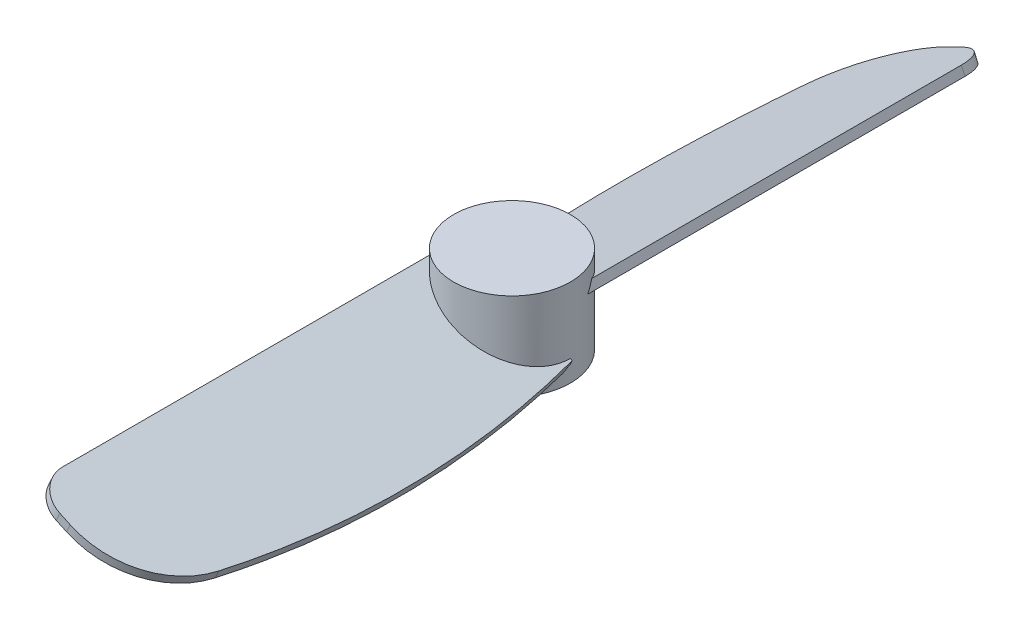
from build123d import *

# Parameters (mm, degrees)
SKETCH1_R           = 2
BOSS_EXTRUDE1_DEPTH = 3
BOSS_EXTRUDE2_DEPTH = 0.15
CIRPATTERN1_COUNT   = 2


with BuildPart() as part:
    # Sketch1 → Boss-Extrude1 (new body)
    with BuildSketch(Plane(origin=(0, 0, 0), x_dir=(1, 0, 0), z_dir=(0, 1, 0))):
        with Locations(Location((0, 0, 0), (0, 0, 270))):
            Circle(SKETCH1_R)
    extrude(amount=BOSS_EXTRUDE1_DEPTH)

    # Sketch3 → Boss-Extrude2 (add, symmetric)
    with BuildSketch(Plane(origin=(0.574533332, 1.232090707, 0), x_dir=(0.9063077870366496, -0.4226182617407003, 0), z_dir=(-0.42261826174070033, -0.9063077870366497, 0))):
        with BuildLine():
            Line((-1.825963844, 0), (-2.618118511, 0.610320395))
            Line((-2.618118511, 0.610320395), (-2.618118511, 13.644717252))
            ThreePointArc((-2.618118511, 13.644717252), (-2.325225292, 14.351824033), (-1.618118511, 14.644717252))
            Line((-1.618118511, 14.644717252), (-1.229872287, 14.644717252))
            ThreePointArc((-1.229872287, 14.644717252), (0.676144985, 13.961417094), (1.713907655, 12.222782692))
            add(Edge.make_bspline(
                [(1.572828445, 0), (2.462700646, 4.059259168), (2.506395313, 8.187064394), (1.713907655, 12.222782692)],
                knots=[0, 0, 0, 0, 0.833038136, 0.833038136, 0.833038136, 0.833038136], degree=3))
            Line((1.572828445, 0), (-1.825963844, 0))
        make_face()
    boss_extrude2 = extrude(amount=BOSS_EXTRUDE2_DEPTH, both=True)

    # CirPattern1: Boss-Extrude2 ×2 about axis
    cirpattern1_axis = Axis((0, 3.15, 0), (0, -1, 0))
    for i in range(1, CIRPATTERN1_COUNT):
        add(boss_extrude2.rotate(cirpattern1_axis, i * 360 / CIRPATTERN1_COUNT))


solid = part.part
